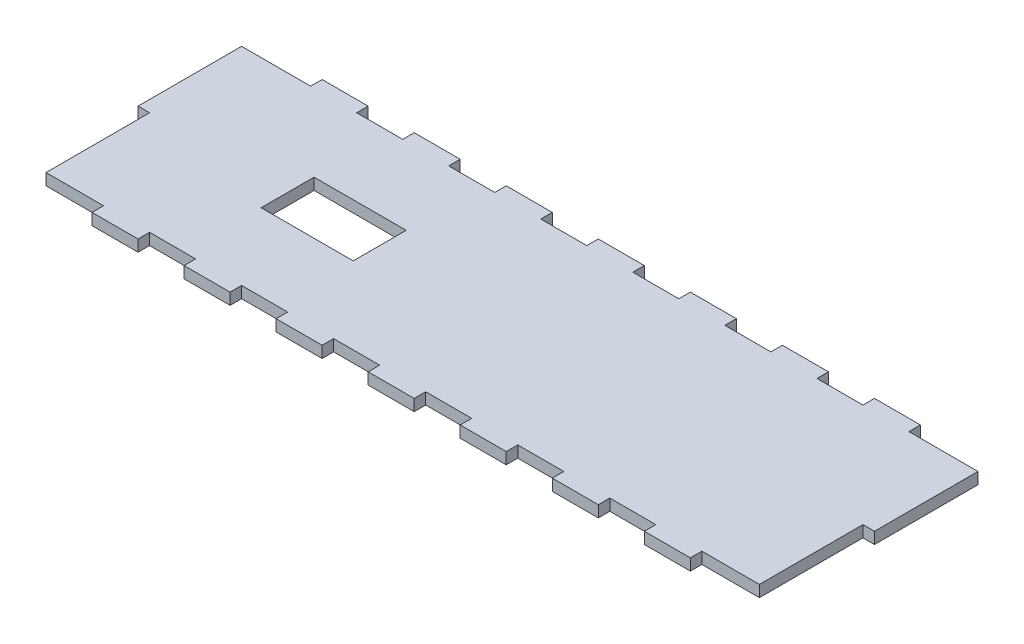
from build123d import *

# Parameters (mm, degrees)
SKETCH1_W           = 160
SKETCH1_H           = 50
BOSS_EXTRUDE1_DEPTH = 1.25
SKETCH2_W           = 10
SKETCH2_H           = 2.5
SKETCH2_W_2         = 15
CUT_EXTRUDE1_DEPTH  = 4
SKETCH3_W           = 2.5
SKETCH3_H           = 22.5
CUT_EXTRUDE2_DEPTH  = 84.852549156
CUT_EXTRUDE3_REACH  = 85.853
SKETCH4_W           = 20
SKETCH4_H           = 11.5


with BuildPart() as part:
    # Sketch1 → Boss-Extrude1 (new, symmetric)
    with BuildSketch(Plane(origin=(0, 0, 0), x_dir=(1, 0, 0), z_dir=(0, 1, 0))):
        Rectangle(SKETCH1_W, SKETCH1_H)
    extrude(amount=BOSS_EXTRUDE1_DEPTH, both=True)

    # Sketch2 → Cut-Extrude1 (cut)
    with BuildSketch(Plane(origin=(0, 1.25, 0), x_dir=(1, 0, 0), z_dir=(0, 1, 0))):
        with Locations((30, 23.75)):
            Rectangle(SKETCH2_W, SKETCH2_H)
        with Locations((10, 23.75)):
            Rectangle(SKETCH2_W, SKETCH2_H)
        with Locations((10, -23.75)):
            Rectangle(SKETCH2_W, SKETCH2_H)
        with Locations((30, -23.75)):
            Rectangle(SKETCH2_W, SKETCH2_H)
        with Locations((50, 23.75)):
            Rectangle(SKETCH2_W, SKETCH2_H)
        with Locations((50, -23.75)):
            Rectangle(SKETCH2_W, SKETCH2_H)
        with Locations((-10, 23.75)):
            Rectangle(SKETCH2_W, SKETCH2_H)
        with Locations((-10, -23.75)):
            Rectangle(SKETCH2_W, SKETCH2_H)
        with Locations((-30, 23.75)):
            Rectangle(SKETCH2_W, SKETCH2_H)
        with Locations((-30, -23.75)):
            Rectangle(SKETCH2_W, SKETCH2_H)
        with Locations((-50, 23.75)):
            Rectangle(SKETCH2_W, SKETCH2_H)
        with Locations((-50, -23.75)):
            Rectangle(SKETCH2_W, SKETCH2_H)
        with Locations((72.5, 23.75)):
            Rectangle(SKETCH2_W_2, SKETCH2_H)
        with Locations((72.5, -23.75)):
            Rectangle(SKETCH2_W_2, SKETCH2_H)
        with Locations((-72.5, 23.75)):
            Rectangle(SKETCH2_W_2, SKETCH2_H)
        with Locations((-72.5, -23.75)):
            Rectangle(SKETCH2_W_2, SKETCH2_H)
    extrude(amount=-CUT_EXTRUDE1_DEPTH, mode=Mode.SUBTRACT)

    # Sketch3 → Cut-Extrude2 (cut, through all)
    with BuildSketch(Plane(origin=(0, 1.25, 0), x_dir=(1, 0, 0), z_dir=(0, 1, 0))):
        with Locations((78.75, -11.25)):
            Rectangle(SKETCH3_W, SKETCH3_H)
        with Locations((-78.75, -11.25)):
            Rectangle(SKETCH3_W, SKETCH3_H)
    extrude(amount=-CUT_EXTRUDE2_DEPTH, mode=Mode.SUBTRACT)

    # Sketch4 → Cut-Extrude3 (cut, up to next)
    with BuildSketch(Plane(origin=(0, -1.25, 0), x_dir=(-1, 0, 0), z_dir=(0, -1, 0)), mode=Mode.PRIVATE) as cut_extrude3_sk1:
        with Locations((37.5, 0)):
            Rectangle(SKETCH4_W, SKETCH4_H)
    cut_extrude3_tool1 = extrude(cut_extrude3_sk1.sketch, amount=-CUT_EXTRUDE3_REACH, mode=Mode.PRIVATE) & part.part
    add(cut_extrude3_tool1.solids().sort_by_distance((-37.5, -1.25, 0))[0], mode=Mode.SUBTRACT)


solid = part.part
